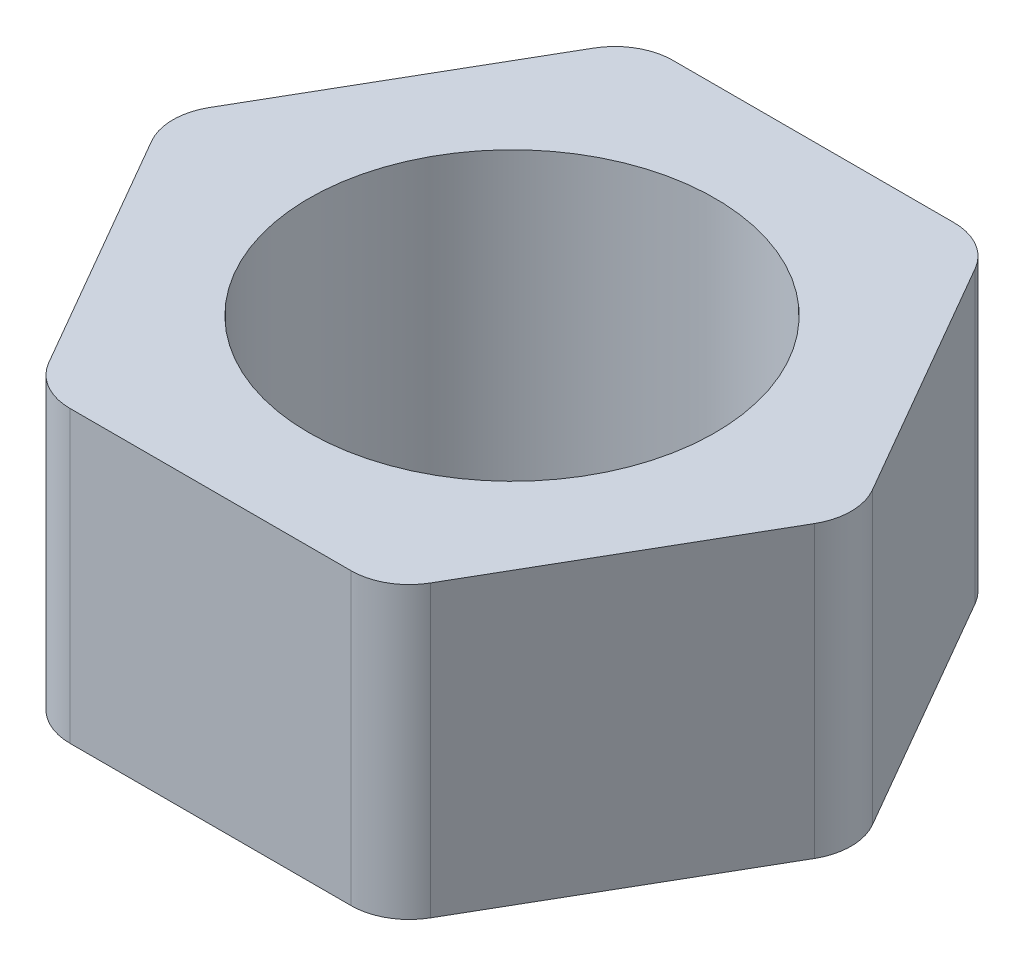
from build123d import *

# Parameters (mm, degrees)
SCHIZZO1_R                   = 1.75
ESTRUSIONE_ESTRUSIONE1_DEPTH = 2.5
RACCORDO1_R                  = 0.5


with BuildPart() as part:
    # Schizzo1 → Estrusione-Estrusione1 (new body)
    with BuildSketch(Plane(origin=(0, 0, 0), x_dir=(1, 0, 0), z_dir=(0, 1, 0))):
        Polygon((-1.5, 2.598076211), (-3, 0), (-1.5, -2.598076211), (1.5, -2.598076211), (3, 0), (1.5, 2.598076211), align=None)
        with Locations(Location((0, 0, 0), (0, 0, 270))):
            Circle(SCHIZZO1_R, mode=Mode.SUBTRACT)
    extrude(amount=ESTRUSIONE_ESTRUSIONE1_DEPTH)

    # Raccordo1
    raccordo1_edges = [part.edges().sort_by_distance(p)[0] for p in [
        (1.5, 1.25, -2.598076211),
        (3, 1.25, 0),
        (1.5, 1.25, 2.598076211),
        (-1.5, 1.25, 2.598076211),
        (-3, 1.25, 0),
        (-1.5, 1.25, -2.598076211),
    ]]
    fillet(raccordo1_edges, radius=RACCORDO1_R)


solid = part.part
